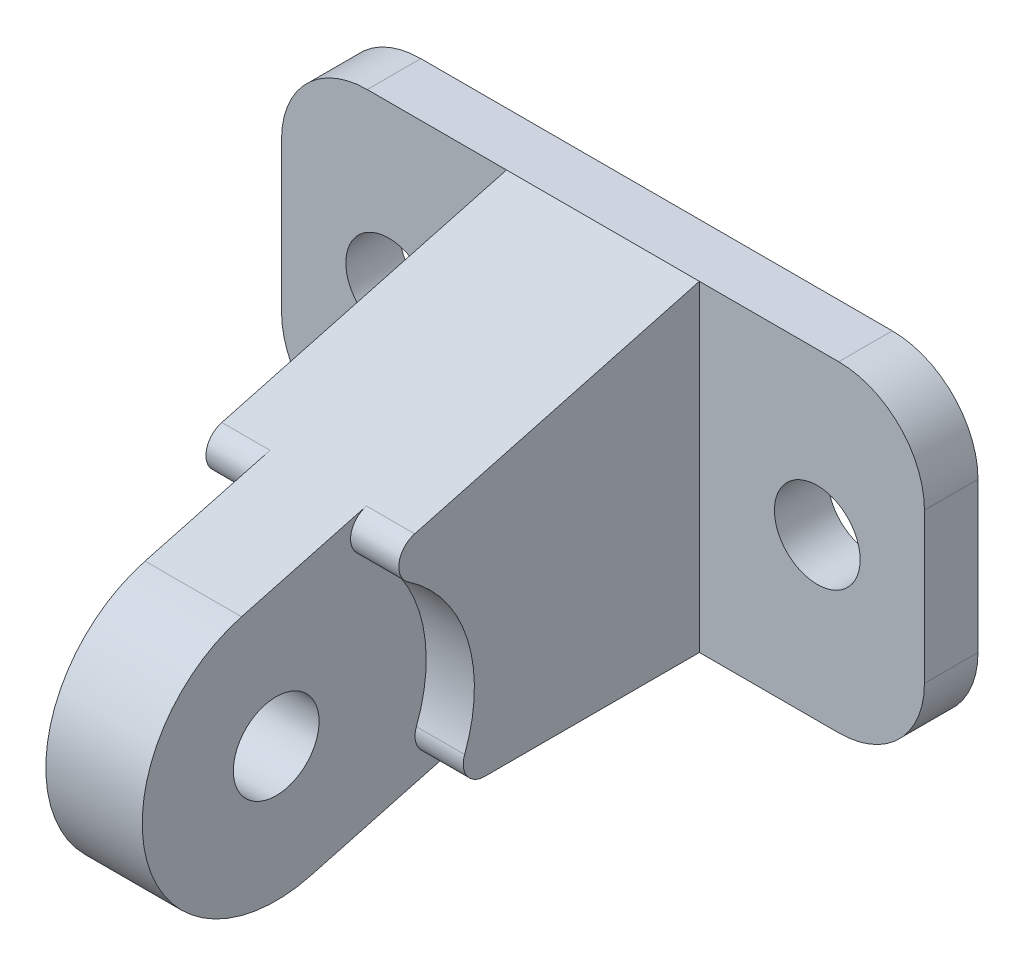
from build123d import *

# Parameters (mm, degrees)
SKETCH1_R           = 4
BOSS_EXTRUDE1_DEPTH = 5
BOSS_EXTRUDE2_DEPTH = 9
SKETCH2_3_R         = 4
BOSS_EXTRUDE3_DEPTH = 4.5


with BuildPart() as part:
    # Sketch1 → Boss-Extrude1 (new body)
    with BuildSketch(Plane.XY):
        with BuildLine():
            Line((22, -15), (-22, -15))
            ThreePointArc((-22, -15), (-27.656854249, -12.656854249), (-30, -7))
            Line((-30, -7), (-30, 7))
            ThreePointArc((-30, 7), (-27.656854249, 12.656854249), (-22, 15))
            Line((-22, 15), (22, 15))
            ThreePointArc((22, 15), (27.656854249, 12.656854249), (30, 7))
            Line((30, 7), (30, -7))
            ThreePointArc((30, -7), (27.656854249, -12.656854249), (22, -15))
        make_face()
        with Locations((-20, 0)):
            Circle(SKETCH1_R, mode=Mode.SUBTRACT)
        with Locations((20, 0)):
            Circle(SKETCH1_R, mode=Mode.SUBTRACT)
    extrude(amount=BOSS_EXTRUDE1_DEPTH)

    # Sketch2 → Boss-Extrude2 (add, symmetric)
    with BuildSketch(Plane(origin=(0, 0, 0), x_dir=(0, 0, -1), z_dir=(1, 0, 0))):
        with BuildLine():
            Line((-5, -15), (-25.04245288, -15))
            ThreePointArc((-25.04245288, -15), (-26.688692003, -14.135736214), (-26.91214627, -12.289896749))
            ThreePointArc((-26.91214627, -12.289896749), (-26.655991742, -3.083912061), (-32.17423683, 4.289332839))
            ThreePointArc((-32.17423683, 4.289332839), (-33.028883618, 6.27753657), (-31.573908753, 7.87954261))
            Line((-31.573908753, 7.87954261), (-5, 15))
            Line((-5, 15), (-5, -15))
        make_face()
    extrude(amount=BOSS_EXTRUDE2_DEPTH, both=True)

    # Sketch2<3> → Boss-Extrude3 (add, symmetric)
    with BuildSketch(Plane(origin=(0, 0, 0), x_dir=(0, 0, -1), z_dir=(1, 0, 0))):
        with BuildLine():
            Line((-36.764761936, -19.393246819), (-20.368941598, -15))
            Line((-20.368941598, -15), (-25.04245288, -15))
            ThreePointArc((-25.04245288, -15), (-26.688692003, -14.135736214), (-26.91214627, -12.289896749))
            ThreePointArc((-26.91214627, -12.289896749), (-26.655991742, -3.083912061), (-32.17423683, 4.289332839))
            ThreePointArc((-32.17423683, 4.289332839), (-33.028883618, 6.27753657), (-31.573908753, 7.87954261))
            Line((-31.573908753, 7.87954261), (-43.235238064, 4.754898838))
            ThreePointArc((-43.235238064, 4.754898838), (-52.074072829, -10.554412054), (-36.764761936, -19.393246819))
        make_face()
        with Locations((-40, -7.31917399)):
            Circle(SKETCH2_3_R, mode=Mode.SUBTRACT)
    extrude(amount=BOSS_EXTRUDE3_DEPTH, both=True)


solid = part.part
